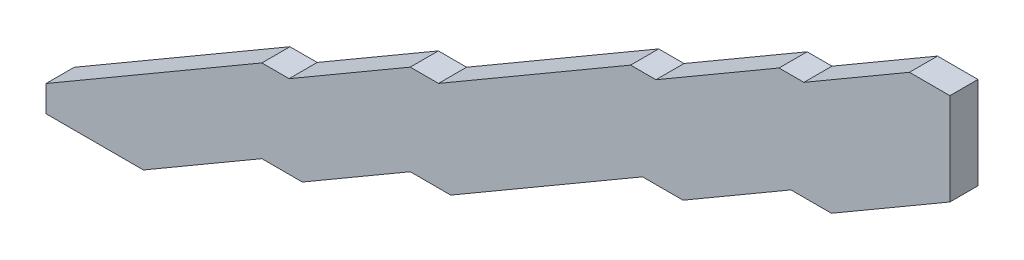
from build123d import *

# Parameters (mm, degrees)
BOSS_EXTRUDE1_DEPTH = 0.335
SCALE1_SCALE        = 1000


with BuildPart() as part:
    # Sketch1 → Boss-Extrude1 (new body)
    with BuildSketch(Plane.XY):
        Polygon((-156.144312786, 57.932949012), (-155.474374306, 57.932949012), (-154.061170753, 58.756224874), (-153.578387864, 58.756224874), (-152.290966825, 59.506224874), (-151.808183936, 59.506224874), (-149.520130982, 60.839153003), (-149.037348093, 60.839153003), (-147.749927055, 61.589153003), (-147.267144165, 61.589153003), (-145.853861634, 62.412474874), (-145.853861634, 63.307931846), (-145.853861634, 63.510944508), (-146.336644524, 63.510944508), (-147.595420344, 62.777632066), (-147.892278278, 62.777632066), (-149.360448908, 61.922334584), (-149.662482206, 61.922334584), (-151.95407609, 60.587343651), (-152.290966825, 60.587343651), (-153.736130653, 59.745449012), (-154.061170753, 59.745449012), (-156.636012829, 58.245449012), (-156.636012829, 57.995449012), (-156.636012829, 57.932949012), align=None)
    extrude(amount=BOSS_EXTRUDE1_DEPTH)


with BuildPart() as part_1:
    # Scale1: scaled about (-150.755992712, 60.7094476, 0.1675)
    add(part.part.scale(SCALE1_SCALE).moved(Location((150605.236719288, -60648.7381524, -167.3325))))


solid = part_1.part
